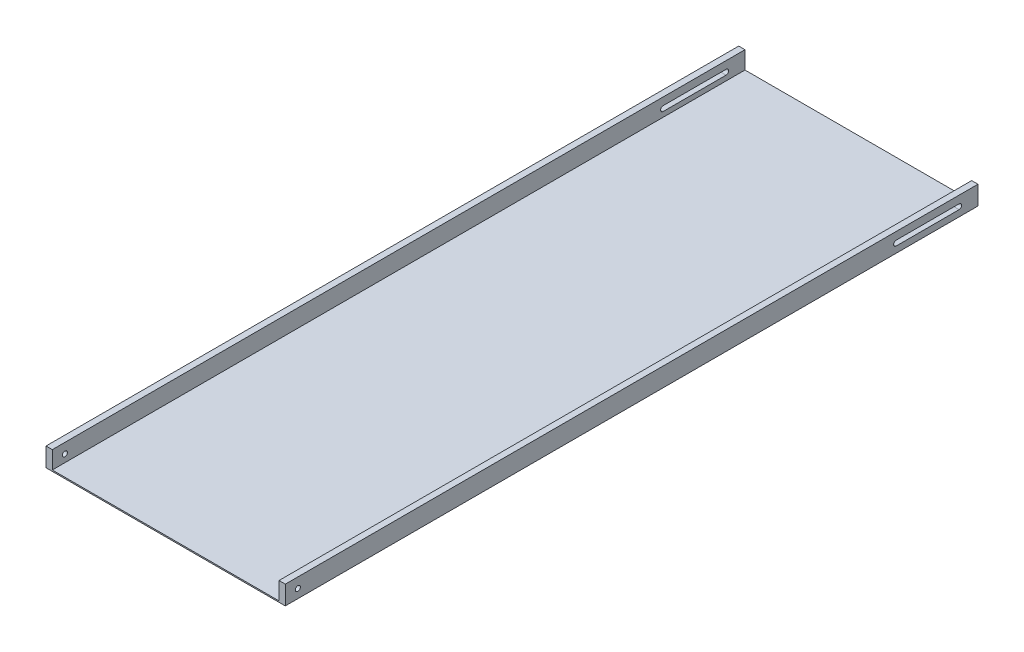
from build123d import *

# Parameters (mm, degrees)
BOSS_EXTRUDE1_DEPTH   = 550
F_4_0MM_DOWEL_HOLE1_D = 4
CUT_EXTRUDE1_DEPTH    = 582.946448297


with BuildPart() as part:
    # Sketch1 → Boss-Extrude1 (new body)
    with BuildSketch(Plane.XY):
        Polygon((-175.647058824, 7.852941176), (-175.647058824, -7.147058824), (14.352941176, -7.147058824), (14.352941176, 7.852941176), (9.352941176, 7.852941176), (9.352941176, -6.147058824), (-170.647058824, -6.147058824), (-170.647058824, 7.852941176), align=None)
    extrude(amount=BOSS_EXTRUDE1_DEPTH)

    # Ø4.0mm Dowel Hole1 (through all)
    with Locations(Plane(origin=(14.352941176, 0, 0), x_dir=(0, 0, -1), z_dir=(1, 0, 0))):
        with Locations((-540, -0.147058824)):
            Hole(F_4_0MM_DOWEL_HOLE1_D / 2)

    # Sketch5 → Cut-Extrude1 (cut, through all)
    with BuildSketch(Plane(origin=(14.352941176, 0, 0), x_dir=(0, 0, -1), z_dir=(1, 0, 0))):
        with BuildLine():
            Line((-65, 1.852941176), (-15, 1.852941176))
            ThreePointArc((-15, 1.852941176), (-13, -0.147058824), (-15, -2.147058824))
            Line((-15, -2.147058824), (-65, -2.147058824))
            ThreePointArc((-65, -2.147058824), (-67, -0.147058824), (-65, 1.852941176))
        make_face()
    extrude(amount=-CUT_EXTRUDE1_DEPTH, mode=Mode.SUBTRACT)


solid = part.part
